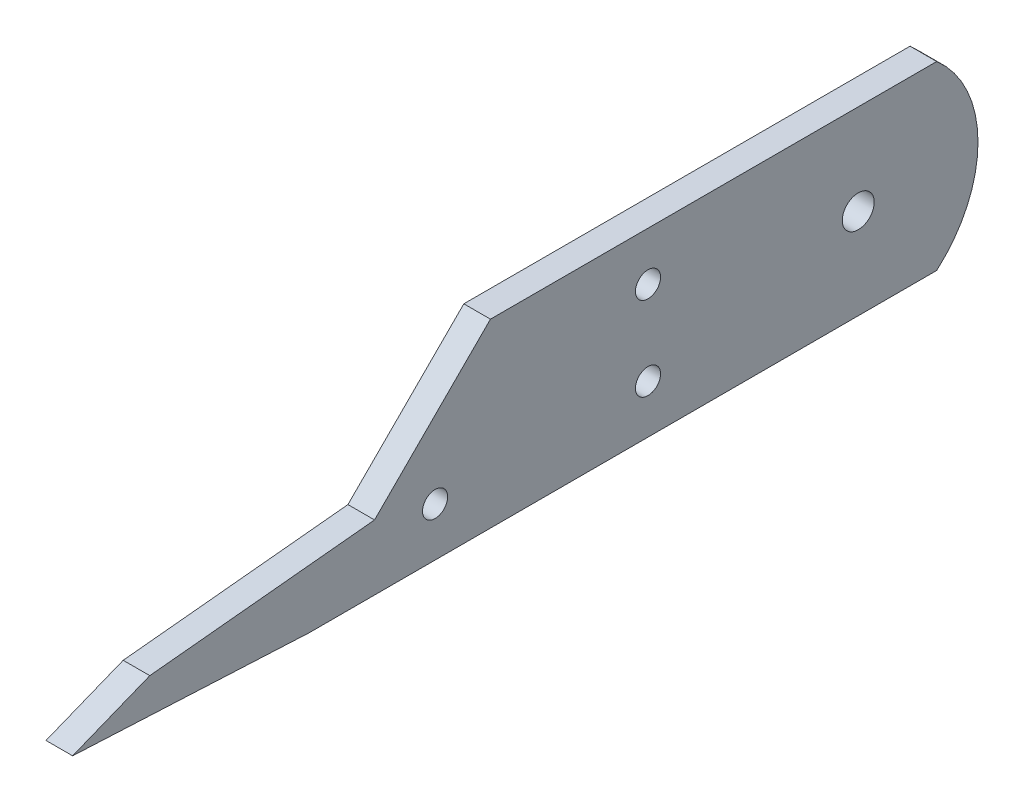
from build123d import *

# Parameters (mm, degrees)
BOSS_EXTRUDE1_DEPTH = 6.35
BOSS_EXTRUDE2_DEPTH = 6.35
CUT_EXTRUDE1_DEPTH  = 176.195383741
SKETCH4_R           = 3
CUT_EXTRUDE2_DEPTH  = 169.439588188
SKETCH5_R           = 3.81
BOSS_EXTRUDE3_DEPTH = 6.35


with BuildPart() as part:
    # Sketch1 → Boss-Extrude1 (new body)
    with BuildSketch(Plane(origin=(0, 0, 0), x_dir=(0, 0, -1), z_dir=(1, 0, 0))):
        with BuildLine():
            Line((-106.172, 0), (-62.992, 43.18))
            Line((-62.992, 43.18), (0, 43.18))
            Line((0, 43.18), (0, 40.64))
            ThreePointArc((0, 40.64), (-6.479930943, 21.59), (0, 2.54))
            Line((0, 2.54), (0, 0))
            Line((0, 0), (-106.172, 0))
        make_face()
    extrude(amount=BOSS_EXTRUDE1_DEPTH)

    # Sketch2 → Boss-Extrude2 (add)
    with BuildSketch(Plane(origin=(6.35, 0, 0), x_dir=(0, 0, -1), z_dir=(1, 0, 0))):
        Polygon((-68.072, 0), (-169.672, 0), (-144.272, 10.16), (-68.072, 17.78), align=None)
    extrude(amount=-BOSS_EXTRUDE2_DEPTH)

    # Sketch3 → Cut-Extrude1 (cut, through all)
    with BuildSketch(Plane(origin=(6.35, 0, 0), x_dir=(0, 0, -1), z_dir=(1, 0, 0))):
        Polygon((-106.172, 0), (-162.687, 2.794), (-169.672, 0), align=None)
    extrude(amount=-CUT_EXTRUDE1_DEPTH, mode=Mode.SUBTRACT)

    # Sketch4 → Cut-Extrude2 (cut, through all)
    with BuildSketch(Plane(origin=(6.35, 0, 0), x_dir=(0, 0, -1), z_dir=(1, 0, 0))):
        with Locations((-25.4, 31.59)):
            Circle(SKETCH4_R)
        with Locations((-25.4, 11.59)):
            Circle(SKETCH4_R)
        with Locations((-76.2, 11.59)):
            Circle(SKETCH4_R)
    extrude(amount=-CUT_EXTRUDE2_DEPTH, mode=Mode.SUBTRACT)

    # Sketch5 → Boss-Extrude3 (add)
    with BuildSketch(Plane.ZY):
        with BuildLine():
            Line((0, 43.18), (-43.481110833, 43.18))
            ThreePointArc((-43.481110833, 43.18), (-53.337069057, 21.59), (-43.481110833, 0))
            Line((-43.481110833, 0), (0, 0))
            Line((0, 0), (0, 2.54))
            ThreePointArc((0, 2.54), (6.479930943, 21.59), (0, 40.64))
            Line((0, 40.64), (0, 43.18))
        make_face()
        with Locations((-24.762069057, 21.59)):
            Circle(SKETCH5_R, mode=Mode.SUBTRACT)
    extrude(amount=-BOSS_EXTRUDE3_DEPTH)


solid = part.part
